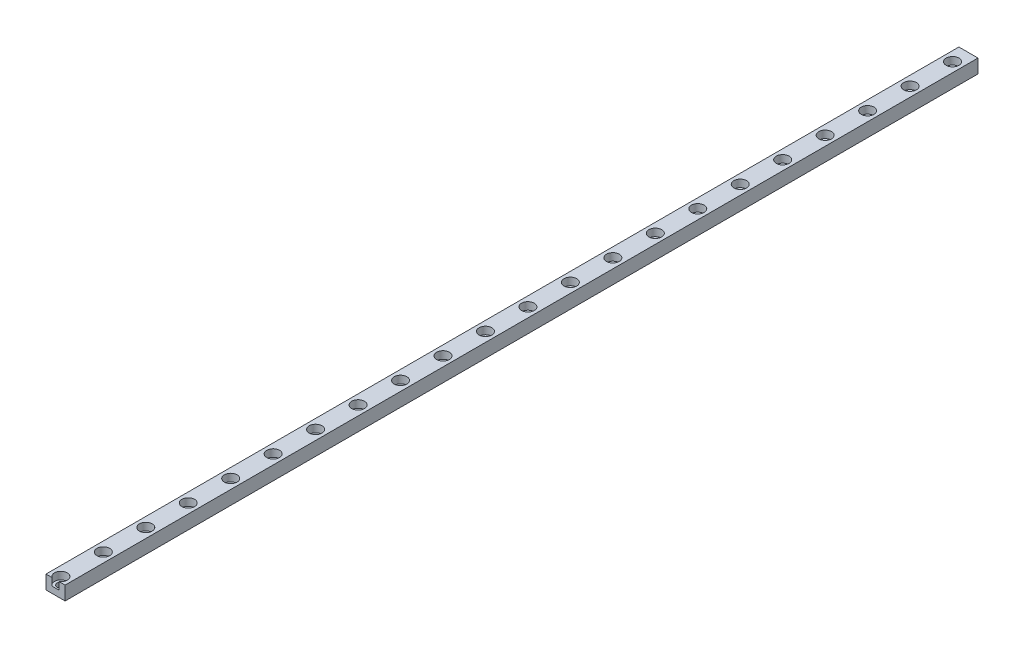
from build123d import *

# Parameters (mm, degrees)
SKETCH_1_W          = 9
SKETCH_1_H          = 6.5
EXTRUDE_1_DEPTH     = 430
SKETCH_2_R          = 1.750000006
CUT_EXTRUDE_1_DEPTH = 341.826868595
SKETCH_3_R          = 3.000000006
CUT_EXTRUDE_2_DEPTH = 3.5


with BuildPart() as part:
    # 草图1 → 凸台-拉伸1 (new body)
    with BuildSketch(Plane.XY.offset(-89.264832522)):
        Rectangle(SKETCH_1_W, SKETCH_1_H)
    extrude(amount=EXTRUDE_1_DEPTH)

    # 草图2 → 切除-拉伸1 (cut, through all)
    with BuildSketch(Plane(origin=(0, 3.25, 0), x_dir=(1, 0, 0), z_dir=(0, 1, 0))):
        with Locations(Location((0, 81.764832522, 0), (0, 0, 270))):
            Circle(SKETCH_2_R)
        with Locations(Location((0, 61.764832522, 0), (0, 0, 270))):
            Circle(SKETCH_2_R)
        with Locations(Location((0, 41.764832522, 0), (0, 0, 270))):
            Circle(SKETCH_2_R)
        with Locations(Location((0, 21.764832522, 0), (0, 0, 270))):
            Circle(SKETCH_2_R)
        with Locations(Location((0, 1.764832522, 0), (0, 0, 270))):
            Circle(SKETCH_2_R)
        with Locations(Location((0, -18.235167478, 0), (0, 0, 270))):
            Circle(SKETCH_2_R)
        with Locations(Location((0, -38.235167478, 0), (0, 0, 270))):
            Circle(SKETCH_2_R)
        with Locations(Location((0, -58.235167478, 0), (0, 0, 270))):
            Circle(SKETCH_2_R)
        with Locations(Location((0, -78.235167478, 0), (0, 0, 270))):
            Circle(SKETCH_2_R)
        with Locations(Location((0, -98.235167478, 0), (0, 0, 270))):
            Circle(SKETCH_2_R)
        with Locations(Location((0, -118.235167478, 0), (0, 0, 270))):
            Circle(SKETCH_2_R)
        with Locations(Location((0, -138.235167478, 0), (0, 0, 270))):
            Circle(SKETCH_2_R)
        with Locations(Location((0, -158.235167478, 0), (0, 0, 270))):
            Circle(SKETCH_2_R)
        with Locations(Location((0, -178.235167478, 0), (0, 0, 270))):
            Circle(SKETCH_2_R)
        with Locations(Location((0, -198.235167478, 0), (0, 0, 270))):
            Circle(SKETCH_2_R)
        with Locations(Location((0, -218.235167478, 0), (0, 0, 270))):
            Circle(SKETCH_2_R)
        with Locations(Location((0, -238.235167478, 0), (0, 0, 270))):
            Circle(SKETCH_2_R)
        with Locations(Location((0, -258.235167478, 0), (0, 0, 270))):
            Circle(SKETCH_2_R)
        with Locations(Location((0, -278.235167478, 0), (0, 0, 270))):
            Circle(SKETCH_2_R)
        with Locations(Location((0, -298.235167478, 0), (0, 0, 270))):
            Circle(SKETCH_2_R)
        with Locations(Location((0, -318.235167478, 0), (0, 0, 270))):
            Circle(SKETCH_2_R)
        with Locations(Location((0, -338.235167478, 0), (0, 0, 270))):
            Circle(SKETCH_2_R)
        with Locations((0, -358.235167478)):
            Circle(SKETCH_2_R)
        with Locations((0, -378.235167478)):
            Circle(SKETCH_2_R)
        with Locations((0, -398.235167478)):
            Circle(SKETCH_2_R)
        with Locations((0, -418.235167478)):
            Circle(SKETCH_2_R)
        with Locations((0, -438.235167478)):
            Circle(SKETCH_2_R)
        with Locations((0, -458.235167478)):
            Circle(SKETCH_2_R)
        with Locations((0, -478.235167478)):
            Circle(SKETCH_2_R)
        with Locations((0, -498.235167478)):
            Circle(SKETCH_2_R)
        with Locations((0, -518.235167478)):
            Circle(SKETCH_2_R)
        with Locations((0, -538.235167478)):
            Circle(SKETCH_2_R)
        with Locations((0, -558.235167478)):
            Circle(SKETCH_2_R)
        with Locations((0, -578.235167478)):
            Circle(SKETCH_2_R)
        with Locations((0, -598.235167478)):
            Circle(SKETCH_2_R)
        with Locations((0, -618.235167478)):
            Circle(SKETCH_2_R)
        with Locations((0, -638.235167478)):
            Circle(SKETCH_2_R)
        with Locations((0, -658.235167478)):
            Circle(SKETCH_2_R)
        with Locations((0, -678.235167478)):
            Circle(SKETCH_2_R)
        with Locations((0, -698.235167478)):
            Circle(SKETCH_2_R)
        with Locations((0, -718.235167478)):
            Circle(SKETCH_2_R)
        with Locations((0, -738.235167478)):
            Circle(SKETCH_2_R)
        with Locations((0, -758.235167478)):
            Circle(SKETCH_2_R)
        with Locations((0, -778.235167478)):
            Circle(SKETCH_2_R)
        with Locations((0, -798.235167478)):
            Circle(SKETCH_2_R)
        with Locations((0, -818.235167478)):
            Circle(SKETCH_2_R)
        with Locations((0, -838.235167478)):
            Circle(SKETCH_2_R)
        with Locations((0, -858.235167478)):
            Circle(SKETCH_2_R)
        with Locations((0, -878.235167478)):
            Circle(SKETCH_2_R)
        with Locations((0, -898.235167478)):
            Circle(SKETCH_2_R)
        with Locations((0, -918.235167478)):
            Circle(SKETCH_2_R)
        with Locations((0, -938.235167478)):
            Circle(SKETCH_2_R)
        with Locations((0, -958.235167478)):
            Circle(SKETCH_2_R)
        with Locations((0, -978.235167478)):
            Circle(SKETCH_2_R)
        with Locations((0, -998.235167478)):
            Circle(SKETCH_2_R)
        with Locations((0, -1018.235167478)):
            Circle(SKETCH_2_R)
        with Locations((0, -1038.235167478)):
            Circle(SKETCH_2_R)
        with Locations((0, -1058.235167478)):
            Circle(SKETCH_2_R)
        with Locations((0, -1078.235167478)):
            Circle(SKETCH_2_R)
        with Locations((0, -1098.235167478)):
            Circle(SKETCH_2_R)
    extrude(amount=-CUT_EXTRUDE_1_DEPTH, mode=Mode.SUBTRACT)

    # 草图3 → 切除-拉伸2 (cut)
    with BuildSketch(Plane(origin=(0, 3.25, 0), x_dir=(1, 0, 0), z_dir=(0, 1, 0))):
        with Locations(Location((0, 81.764832522, 0), (0, 0, 270))):
            Circle(SKETCH_3_R)
        with Locations(Location((0, 61.764832522, 0), (0, 0, 270))):
            Circle(SKETCH_3_R)
        with Locations(Location((0, 41.764832522, 0), (0, 0, 270))):
            Circle(SKETCH_3_R)
        with Locations(Location((0, 21.764832522, 0), (0, 0, 270))):
            Circle(SKETCH_3_R)
        with Locations(Location((0, 1.764832522, 0), (0, 0, 270))):
            Circle(SKETCH_3_R)
        with Locations(Location((0, -18.235167478, 0), (0, 0, 270))):
            Circle(SKETCH_3_R)
        with Locations(Location((0, -38.235167478, 0), (0, 0, 270))):
            Circle(SKETCH_3_R)
        with Locations(Location((0, -58.235167478, 0), (0, 0, 270))):
            Circle(SKETCH_3_R)
        with Locations(Location((0, -78.235167478, 0), (0, 0, 270))):
            Circle(SKETCH_3_R)
        with Locations(Location((0, -98.235167478, 0), (0, 0, 270))):
            Circle(SKETCH_3_R)
        with Locations(Location((0, -118.235167478, 0), (0, 0, 270))):
            Circle(SKETCH_3_R)
        with Locations(Location((0, -138.235167478, 0), (0, 0, 270))):
            Circle(SKETCH_3_R)
        with Locations(Location((0, -158.235167478, 0), (0, 0, 270))):
            Circle(SKETCH_3_R)
        with Locations(Location((0, -178.235167478, 0), (0, 0, 270))):
            Circle(SKETCH_3_R)
        with Locations(Location((0, -198.235167478, 0), (0, 0, 270))):
            Circle(SKETCH_3_R)
        with Locations(Location((0, -218.235167478, 0), (0, 0, 270))):
            Circle(SKETCH_3_R)
        with Locations(Location((0, -238.235167478, 0), (0, 0, 270))):
            Circle(SKETCH_3_R)
        with Locations(Location((0, -258.235167478, 0), (0, 0, 270))):
            Circle(SKETCH_3_R)
        with Locations(Location((0, -278.235167478, 0), (0, 0, 270))):
            Circle(SKETCH_3_R)
        with Locations(Location((0, -298.235167478, 0), (0, 0, 270))):
            Circle(SKETCH_3_R)
        with Locations(Location((0, -318.235167478, 0), (0, 0, 270))):
            Circle(SKETCH_3_R)
        with Locations((0, -338.235167478)):
            Circle(SKETCH_3_R)
        with Locations((0, -358.235167478)):
            Circle(SKETCH_3_R)
        with Locations((0, -378.235167478)):
            Circle(SKETCH_3_R)
        with Locations((0, -398.235167478)):
            Circle(SKETCH_3_R)
        with Locations((0, -418.235167478)):
            Circle(SKETCH_3_R)
        with Locations((0, -438.235167478)):
            Circle(SKETCH_3_R)
        with Locations((0, -458.235167478)):
            Circle(SKETCH_3_R)
        with Locations((0, -478.235167478)):
            Circle(SKETCH_3_R)
        with Locations((0, -498.235167478)):
            Circle(SKETCH_3_R)
        with Locations((0, -518.235167478)):
            Circle(SKETCH_3_R)
        with Locations((0, -538.235167478)):
            Circle(SKETCH_3_R)
        with Locations((0, -558.235167478)):
            Circle(SKETCH_3_R)
        with Locations((0, -578.235167478)):
            Circle(SKETCH_3_R)
        with Locations((0, -598.235167478)):
            Circle(SKETCH_3_R)
        with Locations((0, -618.235167478)):
            Circle(SKETCH_3_R)
        with Locations((0, -638.235167478)):
            Circle(SKETCH_3_R)
        with Locations((0, -658.235167478)):
            Circle(SKETCH_3_R)
        with Locations((0, -678.235167478)):
            Circle(SKETCH_3_R)
        with Locations((0, -698.235167478)):
            Circle(SKETCH_3_R)
        with Locations((0, -718.235167478)):
            Circle(SKETCH_3_R)
        with Locations((0, -738.235167478)):
            Circle(SKETCH_3_R)
        with Locations((0, -758.235167478)):
            Circle(SKETCH_3_R)
        with Locations((0, -778.235167478)):
            Circle(SKETCH_3_R)
        with Locations((0, -798.235167478)):
            Circle(SKETCH_3_R)
        with Locations((0, -818.235167478)):
            Circle(SKETCH_3_R)
        with Locations((0, -838.235167478)):
            Circle(SKETCH_3_R)
        with Locations((0, -858.235167478)):
            Circle(SKETCH_3_R)
        with Locations((0, -878.235167478)):
            Circle(SKETCH_3_R)
        with Locations((0, -898.235167478)):
            Circle(SKETCH_3_R)
        with Locations((0, -918.235167478)):
            Circle(SKETCH_3_R)
        with Locations((0, -938.235167478)):
            Circle(SKETCH_3_R)
        with Locations((0, -958.235167478)):
            Circle(SKETCH_3_R)
        with Locations((0, -978.235167478)):
            Circle(SKETCH_3_R)
        with Locations((0, -998.235167478)):
            Circle(SKETCH_3_R)
        with Locations((0, -1018.235167478)):
            Circle(SKETCH_3_R)
        with Locations((0, -1038.235167478)):
            Circle(SKETCH_3_R)
        with Locations((0, -1058.235167478)):
            Circle(SKETCH_3_R)
        with Locations((0, -1078.235167478)):
            Circle(SKETCH_3_R)
        with Locations((0, -1098.235167478)):
            Circle(SKETCH_3_R)
    extrude(amount=-CUT_EXTRUDE_2_DEPTH, mode=Mode.SUBTRACT)


solid = part.part
